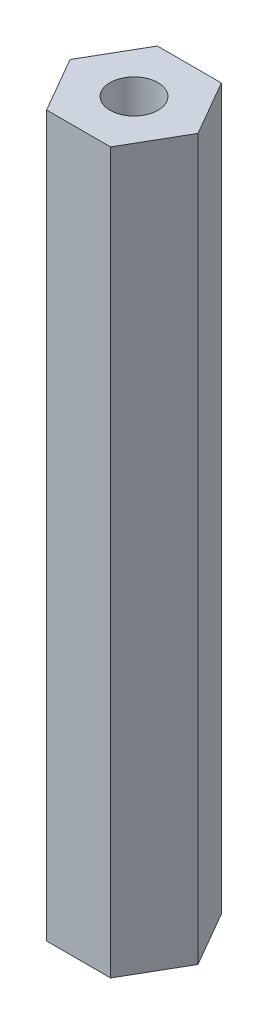
from build123d import *

# Parameters (mm, degrees)
EXTRUDE_1_DEPTH        = 45
SKETCH_2_R             = 1.5
CUT_EXTRUDE_1_DEPTH    = 5
PATTERN_LINEAR_1_COUNT = 2
PATTERN_LINEAR_1_PITCH = 40


with BuildPart() as part:
    # 草图1 → 凸台-拉伸1 (new body)
    with BuildSketch(Plane(origin=(0, 0, 0), x_dir=(1, 0, 0), z_dir=(0, 1, 0))):
        Polygon((4, 0), (2, 3.464101615), (-2, 3.464101615), (-4, 0), (-2, -3.464101615), (2, -3.464101615), align=None)
    extrude(amount=EXTRUDE_1_DEPTH)

    # 草图2 → 切除-拉伸1 (cut)
    with BuildSketch(Plane(origin=(0, 45, 0), x_dir=(1, 0, 0), z_dir=(0, 1, 0))):
        with Locations(Location((0, 0, 0), (0, 0, 270))):
            Circle(SKETCH_2_R)
    cut_extrude_1 = extrude(amount=-CUT_EXTRUDE_1_DEPTH, mode=Mode.SUBTRACT)

    # 阵列(线性)1: 切除-拉伸1 ×2
    with Locations(*[(0, -i * PATTERN_LINEAR_1_PITCH, 0) for i in range(1, PATTERN_LINEAR_1_COUNT)]):
        add(cut_extrude_1, mode=Mode.SUBTRACT)


solid = part.part
